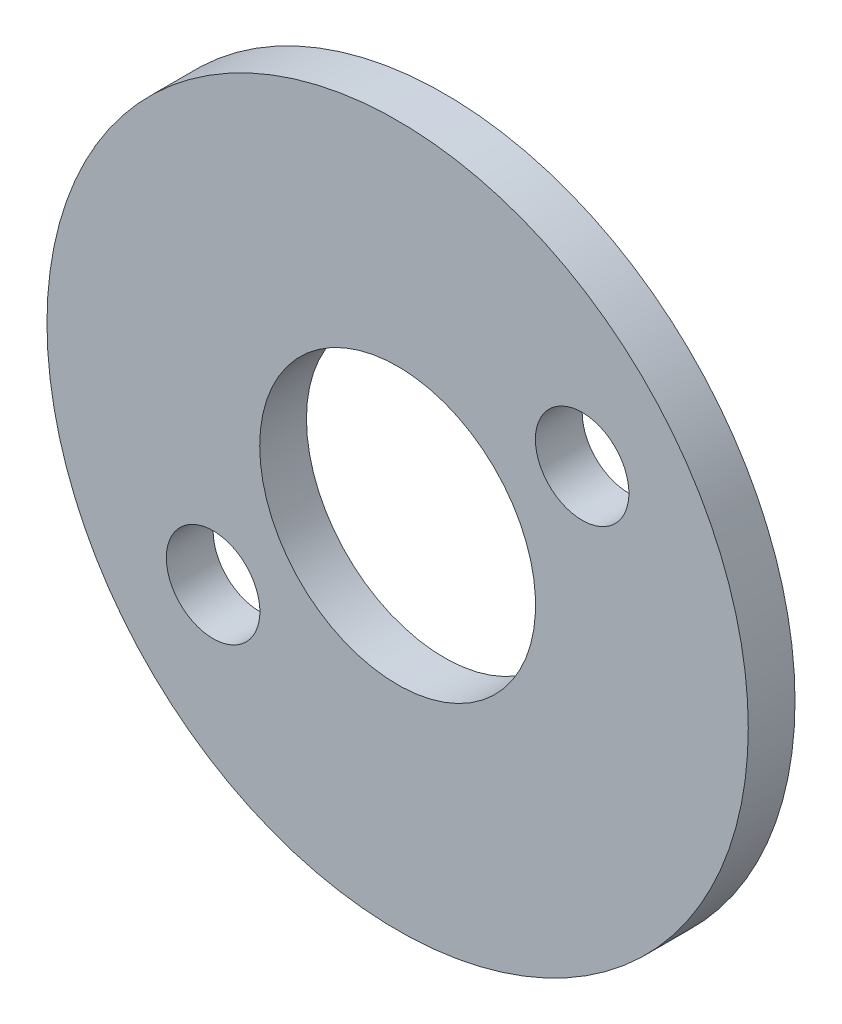
from build123d import *

# Parameters (mm, degrees)
ESQUISSE1_R             = 7.5
BOSS_EXTRU_1_DEPTH      = 1
ESQUISSE2_R             = 2.95
ESQUISSE2_R_2           = 1
ENL_V_MAT_EXTRU_1_DEPTH = 11.653637876


with BuildPart() as part:
    # Esquisse1 → Boss.-Extru.1 (new body)
    with BuildSketch(Plane.XY):
        Circle(ESQUISSE1_R)
    extrude(amount=BOSS_EXTRU_1_DEPTH)

    # Esquisse2 → Enlèv. mat.-Extru.1 (cut, through all)
    with BuildSketch(Plane(origin=(0, 0, 0), x_dir=(-1, 0, 0), z_dir=(0, 0, -1))):
        Circle(ESQUISSE2_R)
        with Locations((-3.946761087, 3.069703068)):
            Circle(ESQUISSE2_R_2)
        with Locations((3.946761087, -3.069703068)):
            Circle(ESQUISSE2_R_2)
    extrude(amount=-ENL_V_MAT_EXTRU_1_DEPTH, mode=Mode.SUBTRACT)


solid = part.part
